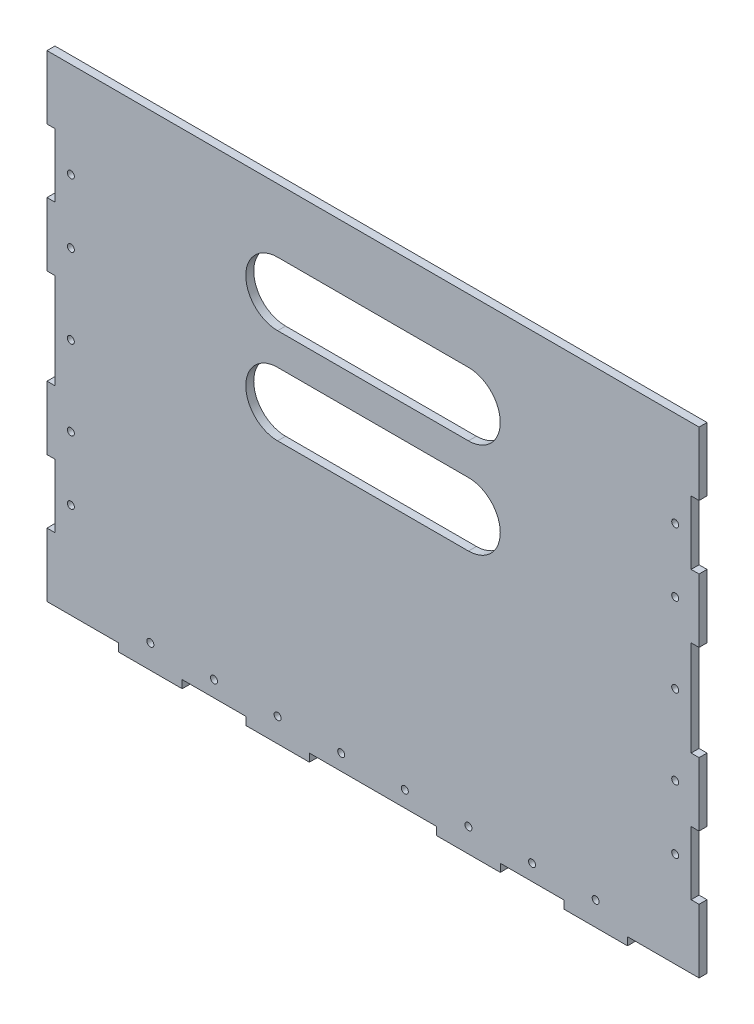
from build123d import *

# Parameters (mm, degrees)
SKETCH_1_R          = 2.2
EXTRUDE_1_DEPTH     = 5
SKETCH_2_W          = 5
SKETCH_2_H          = 220.282443136
SKETCH_2_H_2        = 219.868690955
CUT_EXTRUDE_1_DEPTH = 10
SKETCH_3_W          = 5
SKETCH_3_H          = 40
EXTRUDE_3_DEPTH     = 5
SKETCH_4_W          = 390.4211829
SKETCH_4_H          = 264.690207343
EXTRUDE_4_DEPTH     = 5
SKETCH_5_R          = 2.2
CUT_EXTRUDE_2_DEPTH = 5
CUT_EXTRUDE_3_DEPTH = 10


with BuildPart() as part:
    # 草图1 → 凸台-拉伸1 (new body)
    with BuildSketch(Plane.XY):
        Polygon((-200, 150), (200, 150), (200, 110), (205, 110), (205, 70), (200, 70), (200, 30), (205, 30), (205, -30), (200, -30), (200, -70), (205, -70), (205, -110), (200, -110), (200, -150), (160, -150), (160, -155), (120, -155), (120, -150), (80, -150), (80, -155), (40, -155), (40, -150), (-40, -150), (-40, -155), (-80, -155), (-80, -150), (-120, -150), (-120, -155), (-160, -155), (-160, -150), (-200, -150), (-200, -110), (-205, -110), (-205, -70), (-200, -70), (-200, -30), (-205, -30), (-205, 30), (-200, 30), (-200, 70), (-205, 70), (-205, 110), (-200, 110), align=None)
        with Locations((-140, -140)):
            Circle(SKETCH_1_R, mode=Mode.SUBTRACT)
        with Locations((-100, -140)):
            Circle(SKETCH_1_R, mode=Mode.SUBTRACT)
        with Locations((-60, -140)):
            Circle(SKETCH_1_R, mode=Mode.SUBTRACT)
        with Locations((-20, -140)):
            Circle(SKETCH_1_R, mode=Mode.SUBTRACT)
        with Locations((20, -140)):
            Circle(SKETCH_1_R, mode=Mode.SUBTRACT)
        with Locations((60, -140)):
            Circle(SKETCH_1_R, mode=Mode.SUBTRACT)
        with Locations((100, -140)):
            Circle(SKETCH_1_R, mode=Mode.SUBTRACT)
        with Locations((140, -140)):
            Circle(SKETCH_1_R, mode=Mode.SUBTRACT)
        with Locations((-190, 110)):
            Circle(SKETCH_1_R, mode=Mode.SUBTRACT)
        with Locations((-190, 70)):
            Circle(SKETCH_1_R, mode=Mode.SUBTRACT)
        with Locations((-190, 30)):
            Circle(SKETCH_1_R, mode=Mode.SUBTRACT)
        with Locations((-190, -30)):
            Circle(SKETCH_1_R, mode=Mode.SUBTRACT)
        with Locations((-190, -70)):
            Circle(SKETCH_1_R, mode=Mode.SUBTRACT)
        with Locations((-190, -110)):
            Circle(SKETCH_1_R, mode=Mode.SUBTRACT)
        with Locations((190, -110)):
            Circle(SKETCH_1_R, mode=Mode.SUBTRACT)
        with Locations((190, -70)):
            Circle(SKETCH_1_R, mode=Mode.SUBTRACT)
        with Locations((190, -30)):
            Circle(SKETCH_1_R, mode=Mode.SUBTRACT)
        with Locations((190, 30)):
            Circle(SKETCH_1_R, mode=Mode.SUBTRACT)
        with Locations((190, 70)):
            Circle(SKETCH_1_R, mode=Mode.SUBTRACT)
        with Locations((190, 110)):
            Circle(SKETCH_1_R, mode=Mode.SUBTRACT)
    extrude(amount=EXTRUDE_1_DEPTH)

    # 草图2 → 切除-拉伸1 (cut)
    with BuildSketch(Plane.XY.offset(5)):
        with Locations((-202.5, -0.141221568)):
            Rectangle(SKETCH_2_W, SKETCH_2_H)
        with Locations((202.5, 0.065654522)):
            Rectangle(SKETCH_2_W, SKETCH_2_H_2)
    extrude(amount=-CUT_EXTRUDE_1_DEPTH, mode=Mode.SUBTRACT)

    # 草图3 → 凸台-拉伸3 (add)
    with BuildSketch(Plane.XY.offset(5)):
        with Locations((-202.5, 130)):
            Rectangle(SKETCH_3_W, SKETCH_3_H)
        with Locations((-202.5, 50)):
            Rectangle(SKETCH_3_W, SKETCH_3_H)
        with Locations((-202.5, -50)):
            Rectangle(SKETCH_3_W, SKETCH_3_H)
        with Locations((-202.5, -130)):
            Rectangle(SKETCH_3_W, SKETCH_3_H)
        with Locations((202.5, -130)):
            Rectangle(SKETCH_3_W, SKETCH_3_H)
        with Locations((202.5, -50)):
            Rectangle(SKETCH_3_W, SKETCH_3_H)
        with Locations((202.5, 50)):
            Rectangle(SKETCH_3_W, SKETCH_3_H)
        with Locations((202.5, 130)):
            Rectangle(SKETCH_3_W, SKETCH_3_H)
    extrude(amount=-EXTRUDE_3_DEPTH)

    # 草图4 → 凸台-拉伸4 (add)
    with BuildSketch(Plane.XY.offset(5)):
        with Locations((1.806920954, 7.46039962)):
            Rectangle(SKETCH_4_W, SKETCH_4_H)
    extrude(amount=-EXTRUDE_4_DEPTH)

    # 草图5 → 切除-拉伸2 (cut)
    with BuildSketch(Plane.XY.offset(5)):
        with Locations((-190, 90)):
            Circle(SKETCH_5_R)
        with Locations((-190, 50)):
            Circle(SKETCH_5_R)
        with Locations((-190, 0)):
            Circle(SKETCH_5_R)
        with Locations((-190, -50)):
            Circle(SKETCH_5_R)
        with Locations((-190, -90)):
            Circle(SKETCH_5_R)
        with Locations(Location((190, -90, 0), (0, 0, 180))):
            Circle(SKETCH_5_R)
        with Locations(Location((190, -50, 0), (0, 0, 180))):
            Circle(SKETCH_5_R)
        with Locations(Location((190, 0, 0), (0, 0, 180))):
            Circle(SKETCH_5_R)
        with Locations(Location((190, 50, 0), (0, 0, 180))):
            Circle(SKETCH_5_R)
        with Locations(Location((190, 90, 0), (0, 0, 180))):
            Circle(SKETCH_5_R)
    extrude(amount=-CUT_EXTRUDE_2_DEPTH, mode=Mode.SUBTRACT)

    # 草图6 → 切除-拉伸3 (cut)
    with BuildSketch(Plane.XY.offset(5)):
        with BuildLine():
            Line((-60, 50), (60, 50))
            ThreePointArc((60, 50), (80, 30), (60, 10))
            Line((60, 10), (-60, 10))
            ThreePointArc((-60, 10), (-80, 30), (-60, 50))
        make_face()
        with BuildLine():
            Line((-60, 110), (60, 110))
            ThreePointArc((60, 110), (80, 90), (60, 70))
            Line((60, 70), (-60, 70))
            ThreePointArc((-60, 70), (-80, 90), (-60, 110))
        make_face()
    extrude(amount=-CUT_EXTRUDE_3_DEPTH, mode=Mode.SUBTRACT)


solid = part.part
